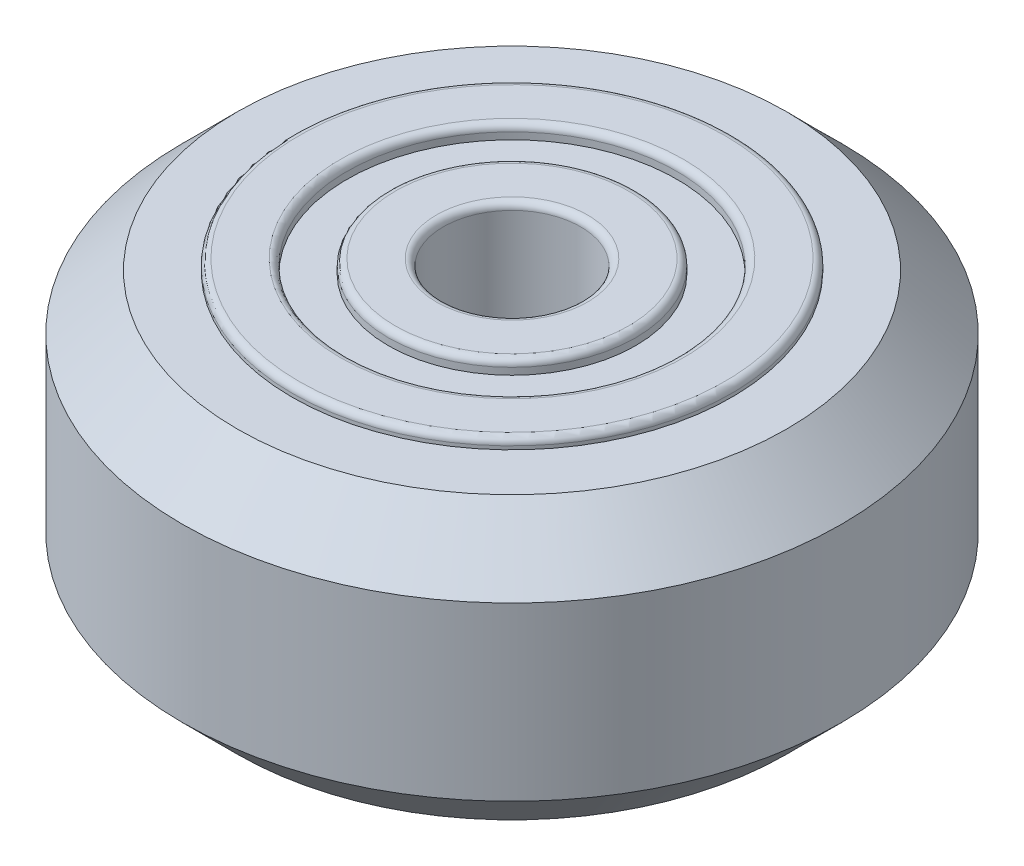
from build123d import *

# Parameters (mm, degrees)
SKETCH2_R             = 12
SKETCH2_R_2           = 8
BOSS_EXTRUDE1_DEPTH   = 5.125
SKETCH2_3_R           = 8
SKETCH2_3_R_2         = 6
BOSS_EXTRUDE2_DEPTH   = 5.5
SKETCH2_3_R_3         = 4.5
SKETCH2_3_R_4         = 2.5
BOSS_EXTRUDE2_2_DEPTH = 5.5
SKETCH2_5_R           = 6
SKETCH2_5_R_2         = 4.5
BOSS_EXTRUDE3_DEPTH   = 5
CHAMFER1_SIZE         = 2
FILLET1_R             = 0.25


with BuildPart() as part:
    # Sketch2 → Boss-Extrude1 (new, symmetric)
    with BuildSketch(Plane(origin=(0, 0, 0), x_dir=(1, 0, 0), z_dir=(0, 1, 0))):
        with Locations(Location((0, 0, 0), (0, 0, 270))):
            Circle(SKETCH2_R)
        with Locations(Location((0, 0, 0), (0, 0, 270))):
            Circle(SKETCH2_R_2, mode=Mode.SUBTRACT)
    extrude(amount=BOSS_EXTRUDE1_DEPTH, both=True)

    # Chamfer1
    chamfer1_edges = [part.edges().sort_by_distance(p)[0] for p in [
        (0, 5.125, -12),
        (0, -5.125, -12),
    ]]
    chamfer(chamfer1_edges, length=CHAMFER1_SIZE)


with BuildPart() as body_2:
    # Sketch2<3> → Boss-Extrude2 (new, symmetric)
    with BuildSketch(Plane(origin=(0, 0, 0), x_dir=(1, 0, 0), z_dir=(0, 1, 0))):
        with Locations(Location((0, 0, 0), (0, 0, 270))):
            Circle(SKETCH2_3_R)
        with Locations(Location((0, 0, 0), (0, 0, 270))):
            Circle(SKETCH2_3_R_2, mode=Mode.SUBTRACT)
    extrude(amount=BOSS_EXTRUDE2_DEPTH, both=True)



with BuildPart() as body_3:
    # Sketch2<3> → Boss-Extrude2 2 (new, symmetric)
    with BuildSketch(Plane(origin=(0, 0, 0), x_dir=(1, 0, 0), z_dir=(0, 1, 0))):
        with Locations(Location((0, 0, 0), (0, 0, 270))):
            Circle(SKETCH2_3_R_3)
        with Locations(Location((0, 0, 0), (0, 0, 270))):
            Circle(SKETCH2_3_R_4, mode=Mode.SUBTRACT)
    extrude(amount=BOSS_EXTRUDE2_2_DEPTH, both=True)


with BuildPart() as body_2_1:
    add(body_2.part)

    add(body_3.part)  # Boss-Extrude3 merges body 3
    # Sketch2<5> → Boss-Extrude3 (add, symmetric)
    with BuildSketch(Plane(origin=(0, 0, 0), x_dir=(1, 0, 0), z_dir=(0, 1, 0))):
        with Locations(Location((0, 0, 0), (0, 0, 270))):
            Circle(SKETCH2_5_R)
        with Locations(Location((0, 0, 0), (0, 0, 270))):
            Circle(SKETCH2_5_R_2, mode=Mode.SUBTRACT)
    extrude(amount=BOSS_EXTRUDE3_DEPTH, both=True)

    # Fillet1
    fillet1_edges = [body_2_1.edges().sort_by_distance(p)[0] for p in [
        (0, 5.5, -4.5),
        (0, 5.5, -6),
        (0, -5.5, -8),
        (0, 5.5, -8),
        (0, -5.5, -6),
        (0, -5.5, -4.5),
        (0, -5.5, -2.5),
        (0, 5.5, -2.5),
    ]]
    fillet(fillet1_edges, radius=FILLET1_R)


solid = Compound([part.part, body_2_1.part])
